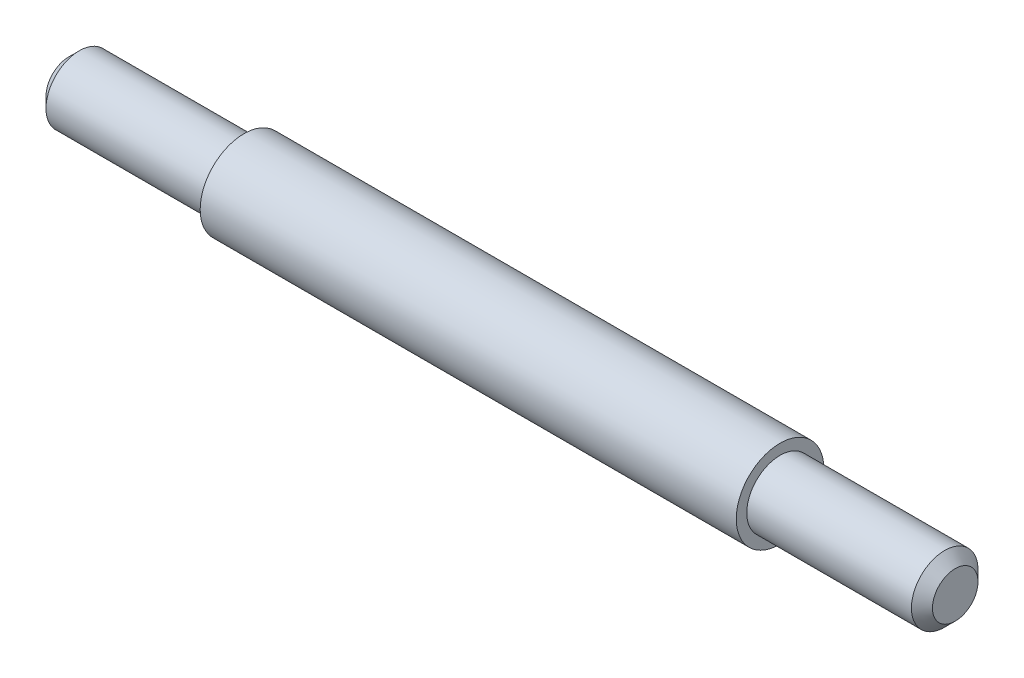
from build123d import *

# Parameters (mm, degrees)
CHAMFER1_SIZE = 0.762
CHAMFER2_SIZE = 0.762


with BuildPart() as part:
    # Sketch3 → Revolve1 (revolve)
    with BuildSketch(Plane.XY, mode=Mode.PRIVATE) as revolve1_sk:
        Polygon((-32.131, 0), (32.131, 0), (32.131, 2.413), (19.431, 2.413), (19.431, 3.175), (-19.431, 3.175), (-19.431, 2.413), (-32.131, 2.413), align=None)
    revolve(revolve1_sk.sketch.rotate(Axis((-32.131, 0, 0), (1, 0, 0)), 90), axis=Axis((-32.131, 0, 0), (1, 0, 0)))

    # Chamfer1
    chamfer1_edges = [part.edges().sort_by_distance(p)[0] for p in [
        (-32.131, 0, -2.413),
    ]]
    chamfer(chamfer1_edges, length=CHAMFER1_SIZE)

    # Chamfer2
    chamfer2_edges = [part.edges().sort_by_distance(p)[0] for p in [
        (32.131, 0, -2.413),
    ]]
    chamfer(chamfer2_edges, length=CHAMFER2_SIZE)


solid = part.part
